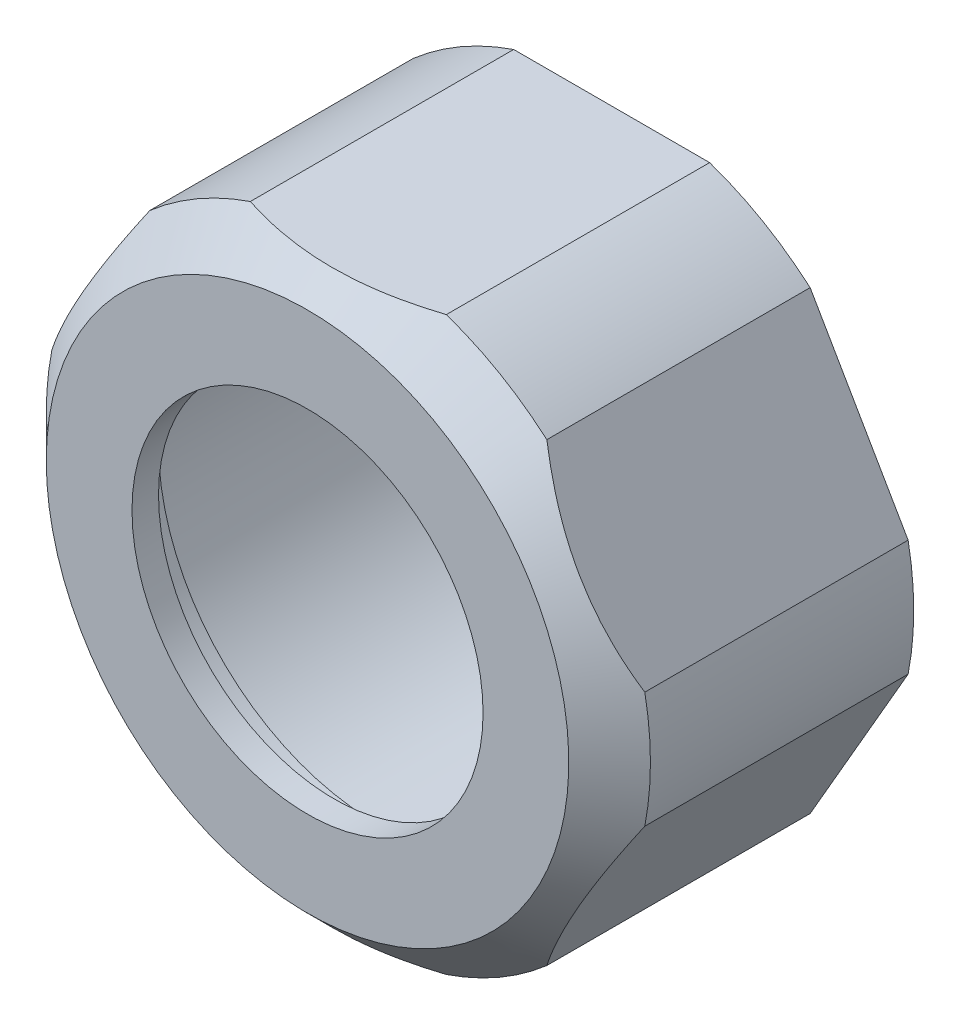
from build123d import *

# Parameters (mm, degrees)
SKETCH_2_R          = 10
CUT_EXTRUDE_2_DEPTH = 13.84610836
CHAMFER_1_SIZE      = 0.3


with BuildPart() as part:
    # Эскиз1 → Повернуть1 (revolve)
    with BuildSketch(Plane(origin=(0, 0, 0), x_dir=(1, 0, 0), z_dir=(0, 1, 0)), mode=Mode.PRIVATE) as revolve_1_sk:
        Polygon((4.3, -7.45), (6.4, -7.45), (7.4, -6.45), (7.4, 0), (5.65, 0), (5.65, -5.75), (5.35, -5.75), (5.35, -6.8), (4.3, -6.8), align=None)
    revolve(revolve_1_sk.sketch.rotate(Axis((0, 0, 0), (0, 0, 1)), 180), axis=Axis((0, 0, 0), (0, 0, 1)))

    # Эскиз2 → Вырез-Вытянуть2 (cut, through all)
    with BuildSketch(Plane.XY):
        Circle(SKETCH_2_R)
        Polygon((8.082903769, 0), (4.041451884, 7), (-4.041451884, 7), (-8.082903769, 0), (-4.041451884, -7), (4.041451884, -7), align=None, mode=Mode.SUBTRACT)
    extrude(amount=CUT_EXTRUDE_2_DEPTH, mode=Mode.SUBTRACT)

    # Фаска1
    chamfer_1_edges = [part.edges().sort_by_distance(p)[0] for p in [
        (5.65, 0, 0),
    ]]
    chamfer(chamfer_1_edges, length=CHAMFER_1_SIZE)


solid = part.part
